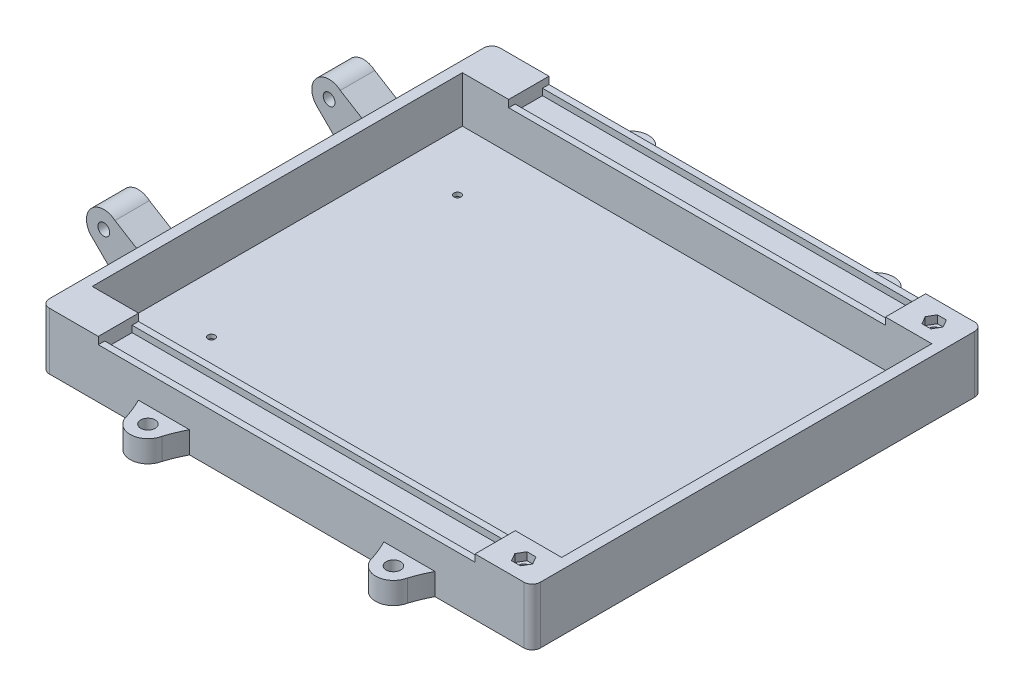
from build123d import *

# Parameters (mm, degrees)
SKETCH18_W           = 228.04
SKETCH18_H           = 171.92
BOSS_EXTRUDE6_DEPTH  = 26.5
SKETCH20_W           = 218.04
SKETCH20_H           = 171.92
CUT_EXTRUDE6_DEPTH   = 21.5
SKETCH22_W           = 228.04
SKETCH22_H           = 18.7
BOSS_EXTRUDE7_DEPTH  = 26.5
SKETCH23_W           = 228.04
SKETCH23_H           = 18.7
BOSS_EXTRUDE8_DEPTH  = 26.5
SKETCH24_W           = 175
SKETCH24_H           = 18.7
CUT_EXTRUDE7_DEPTH   = 3.35
SKETCH25_W           = 175
SKETCH25_H           = 18.7
CUT_EXTRUDE8_DEPTH   = 3.35
SKETCH27_W           = 175
SKETCH27_H           = 12.7
CUT_EXTRUDE9_DEPTH   = 3
SKETCH28_W           = 175
SKETCH28_H           = 12.7
CUT_EXTRUDE10_DEPTH  = 3
SKETCH31_R           = 1.65
SKETCH31_R_2         = 1.651
CUT_EXTRUDE15_DEPTH  = 1.825
CUT_EXTRUDE17_DEPTH  = 3.175
SKETCH38_R           = 2.75
BOSS_EXTRUDE12_DEPTH = 8
SKETCH39_R           = 2.2
CUT_EXTRUDE18_DEPTH  = 26.5
SKETCH40_R           = 4.4
CUT_EXTRUDE19_DEPTH  = 20.9
FILLET1_R            = 3.81
CUT_EXTRUDE20_DEPTH  = 3.6
SKETCH47_R           = 3.3782
BOSS_EXTRUDE14_DEPTH = 10.16


with BuildPart() as part:
    # Sketch18 → Boss-Extrude6 (new body)
    with BuildSketch(Plane(origin=(0, 0, 0), x_dir=(1, 0, 0), z_dir=(0, 1, 0))):
        Rectangle(SKETCH18_W, SKETCH18_H)
    extrude(amount=BOSS_EXTRUDE6_DEPTH)

    # Sketch20 → Cut-Extrude6 (cut)
    with BuildSketch(Plane(origin=(0, 26.5, 0), x_dir=(1, 0, 0), z_dir=(0, 1, 0))):
        Rectangle(SKETCH20_W, SKETCH20_H)
    extrude(amount=-CUT_EXTRUDE6_DEPTH, mode=Mode.SUBTRACT)

    # Sketch22 → Boss-Extrude7 (add)
    with BuildSketch(Plane(origin=(0, 0, 0), x_dir=(1, 0, 0), z_dir=(0, 1, 0))):
        with Locations((0, -95.31)):
            Rectangle(SKETCH22_W, SKETCH22_H)
    extrude(amount=BOSS_EXTRUDE7_DEPTH)

    # Sketch23 → Boss-Extrude8 (add)
    with BuildSketch(Plane(origin=(0, 0, 0), x_dir=(1, 0, 0), z_dir=(0, 1, 0))):
        with Locations((0, 95.31)):
            Rectangle(SKETCH23_W, SKETCH23_H)
    extrude(amount=BOSS_EXTRUDE8_DEPTH)

    # Sketch24 → Cut-Extrude7 (cut)
    with BuildSketch(Plane(origin=(0, 26.5, 0), x_dir=(1, 0, 0), z_dir=(0, 1, 0))):
        with Locations((0, 95.31)):
            Rectangle(SKETCH24_W, SKETCH24_H)
    extrude(amount=-CUT_EXTRUDE7_DEPTH, mode=Mode.SUBTRACT)

    # Sketch25 → Cut-Extrude8 (cut)
    with BuildSketch(Plane(origin=(0, 26.5, 0), x_dir=(1, 0, 0), z_dir=(0, 1, 0))):
        with Locations((0, -95.31)):
            Rectangle(SKETCH25_W, SKETCH25_H)
    extrude(amount=-CUT_EXTRUDE8_DEPTH, mode=Mode.SUBTRACT)

    # Sketch27 → Cut-Extrude9 (cut)
    with BuildSketch(Plane(origin=(0, 23.15, 0), x_dir=(1, 0, 0), z_dir=(0, 1, 0))):
        with Locations((0, -95.31)):
            Rectangle(SKETCH27_W, SKETCH27_H)
    extrude(amount=-CUT_EXTRUDE9_DEPTH, mode=Mode.SUBTRACT)

    # Sketch28 → Cut-Extrude10 (cut)
    with BuildSketch(Plane(origin=(0, 23.15, 0), x_dir=(1, 0, 0), z_dir=(0, 1, 0))):
        with Locations((0, 95.31)):
            Rectangle(SKETCH28_W, SKETCH28_H)
    extrude(amount=-CUT_EXTRUDE10_DEPTH, mode=Mode.SUBTRACT)

    # Sketch31 → Cut-Extrude15 (cut)
    with BuildSketch(Plane(origin=(0, 5, 0), x_dir=(1, 0, 0), z_dir=(0, 1, 0))):
        with Locations((-82.448, 57.15)):
            Circle(SKETCH31_R)
        with Locations((101.448, 57.15)):
            Circle(SKETCH31_R_2)
        with Locations((101.448, -57.15)):
            Circle(SKETCH31_R_2)
        with Locations((-82.448, -57.15)):
            Circle(SKETCH31_R)
    extrude(amount=-CUT_EXTRUDE15_DEPTH, mode=Mode.SUBTRACT)

    # Sketch33 → Cut-Extrude17 (cut)
    with BuildSketch(Plane.XZ):
        Polygon((-79.316971755, -58.9577), (-79.316971755, -55.3423), (-82.448, -53.5346), (-85.579028245, -55.3423), (-85.579028245, -58.9577), (-82.448, -60.7654), align=None)
        Polygon((104.579028245, -58.9577), (104.579028245, -55.3423), (101.448, -53.5346), (98.316971755, -55.3423), (98.316971755, -58.9577), (101.448, -60.7654), align=None)
        Polygon((-79.316971755, 58.9577), (-82.448, 60.7654), (-85.579028245, 58.9577), (-85.579028245, 55.3423), (-82.448, 53.5346), (-79.316971755, 55.3423), align=None)
        Polygon((98.316971755, 58.9577), (98.316971755, 55.3423), (101.448, 53.5346), (104.579028245, 55.3423), (104.579028245, 58.9577), (101.448, 60.7654), align=None)
    extrude(amount=-CUT_EXTRUDE17_DEPTH, mode=Mode.SUBTRACT)

    # Sketch38 → Boss-Extrude12 (add, symmetric)
    with BuildSketch(Plane.XY.offset(-52.33)):
        with BuildLine():
            Line((-114.02, 0), (-134.455863104, 20.352550116))
            ThreePointArc((-134.455863104, 20.352550116), (-135.406416884, 31.696896104), (-124.062070896, 32.647449884))
            Line((-124.062070896, 32.647449884), (-114.02, 26.5))
            Line((-114.02, 26.5), (-114.02, 0))
        make_face()
        with Locations((-129.258967, 26.5)):
            Circle(SKETCH38_R, mode=Mode.SUBTRACT)
    boss_extrude12 = extrude(amount=BOSS_EXTRUDE12_DEPTH, both=True)

    # Mirror2: Boss-Extrude12 across plane
    add(boss_extrude12.mirror(Plane.XY))

    # Sketch39 → Cut-Extrude18 (cut)
    with BuildSketch(Plane(origin=(0, 26.5, 0), x_dir=(1, 0, 0), z_dir=(0, 1, 0))):
        with Locations((100.76, 95.31)):
            Circle(SKETCH39_R)
    cut_extrude18 = extrude(amount=-CUT_EXTRUDE18_DEPTH, mode=Mode.SUBTRACT)

    # Sketch40 → Cut-Extrude19 (cut)
    with BuildSketch(Plane.XZ):
        with Locations((100.76, -95.31)):
            Circle(SKETCH40_R)
    cut_extrude19 = extrude(amount=-CUT_EXTRUDE19_DEPTH, mode=Mode.SUBTRACT)

    # Mirror3: Cut-Extrude18 across plane
    add(cut_extrude18.mirror(Plane.XY), mode=Mode.SUBTRACT)

    # Mirror4: Cut-Extrude19 across plane
    add(cut_extrude19.mirror(Plane.XY), mode=Mode.SUBTRACT)

    # Fillet1
    fillet1_edges = [part.edges().sort_by_distance(p)[0] for p in [
        (114.02, 13.25, 104.66),
        (-114.02, 13.25, 104.66),
        (-114.02, 13.25, -104.66),
        (114.02, 13.25, -104.66),
    ]]
    fillet(fillet1_edges, radius=FILLET1_R)

    # Sketch41 → Cut-Extrude20 (cut)
    with BuildSketch(Plane(origin=(0, 26.5, 0), x_dir=(1, 0, 0), z_dir=(0, 1, 0))):
        Polygon((98.681539031, -91.71), (96.603078062, -95.31), (98.681539031, -98.91), (102.838460969, -98.91), (104.916921938, -95.31), (102.838460969, -91.71), align=None)
    cut_extrude20 = extrude(amount=-CUT_EXTRUDE20_DEPTH, mode=Mode.SUBTRACT)

    # Mirror5: Cut-Extrude20 across plane
    add(cut_extrude20.mirror(Plane.XY), mode=Mode.SUBTRACT)

    # Sketch47 → Boss-Extrude14 (add)
    # profile 1 of 2: a face of its own
    with BuildSketch(Plane.XZ):
        with BuildLine():
            ThreePointArc((45.13728714, -104.66), (47.210651626, -109.12978233), (48.903154853, -113.757225166))
            ThreePointArc((48.903154853, -113.757225166), (57.01, -120.350559583), (65.116845147, -113.757225166))
            ThreePointArc((65.116845147, -113.757225166), (66.809348374, -109.12978233), (68.88271286, -104.66))
            Line((68.88271286, -104.66), (57.122870876, -104.66))
            Line((57.122870876, -104.66), (45.13728714, -104.66))
        make_face()
        with Locations((57.01, -112.07)):
            Circle(SKETCH47_R, mode=Mode.SUBTRACT)
    # profile 2 of 2: a face of its own
    with BuildSketch(Plane.XZ):
        with BuildLine():
            ThreePointArc((-48.903154853, -113.757225166), (-47.210651626, -109.12978233), (-45.13728714, -104.66))
            Line((-45.13728714, -104.66), (-57.122870876, -104.66))
            Line((-57.122870876, -104.66), (-68.88271286, -104.66))
            ThreePointArc((-68.88271286, -104.66), (-66.809348374, -109.12978233), (-65.116845147, -113.757225166))
            ThreePointArc((-65.116845147, -113.757225166), (-57.01, -120.350559583), (-48.903154853, -113.757225166))
        make_face()
        with Locations((-57.01, -112.07)):
            Circle(SKETCH47_R, mode=Mode.SUBTRACT)
    boss_extrude14 = extrude(amount=-BOSS_EXTRUDE14_DEPTH)

    # Mirror6: Boss-Extrude14 across plane
    add(boss_extrude14.mirror(Plane.XY))


solid = part.part
